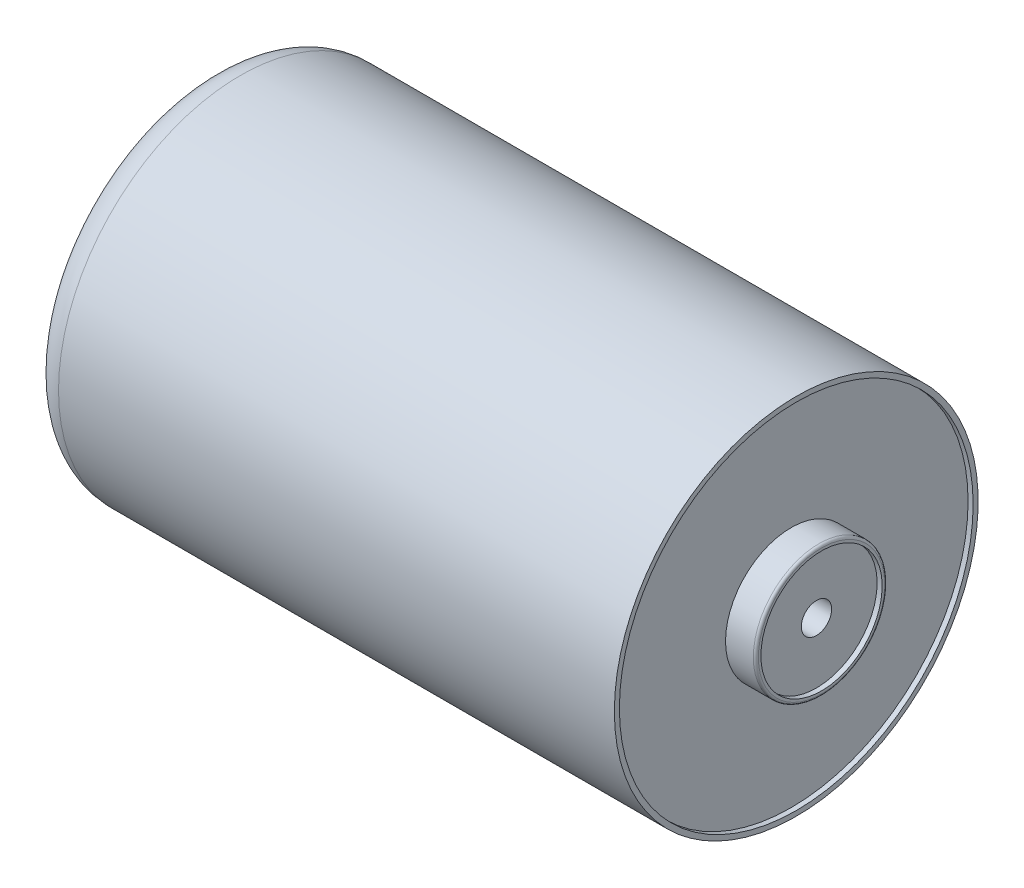
from build123d import *

# Parameters (mm, degrees)
CONG_1_R                = 0.25
CONG_2_R                = 3
ESQUISSE2_R             = 1
ENL_V_MAT_EXTRU_1_DEPTH = 10


with BuildPart() as part:
    # Esquisse1 → Révolution1 (revolve)
    with BuildSketch(Plane.XY, mode=Mode.PRIVATE) as r_volution1_sk:
        Polygon((15.571393841, 1.5), (6.47350081, 1.5), (6.47350081, 6), (5.97350081, 6), (5.97350081, 6.5), (10.47350081, 6.5), (10.47350081, 18), (68.47350081, 18), (68.47350081, 17.502971724), (67.97350081, 17.502971724), (67.97350081, 6.5), (70.97350081, 6.5), (70.97350081, 6), (70.47350081, 6), (70.47350081, 1.5), align=None)
    revolve(r_volution1_sk.sketch.rotate(Axis((0, 0, 0), (1, 0, 0)), 90), axis=Axis((0, 0, 0), (1, 0, 0)))

    # Congé1
    cong_1_edges = [part.edges().sort_by_distance(p)[0] for p in [
        (70.97350081, 0, -6.5),
        (10.47350081, 0, -6.5),
        (5.97350081, 0, -6.5),
    ]]
    fillet(cong_1_edges, radius=CONG_1_R)

    # Congé2
    cong_2_edges = [part.edges().sort_by_distance(p)[0] for p in [
        (10.47350081, 0, -18),
    ]]
    fillet(cong_2_edges, radius=CONG_2_R)

    # Esquisse2 → Enlèv. mat.-Extru.1 (cut)
    with BuildSketch(Plane.ZY.offset(-10.47350081)):
        with Locations((12.5, 0)):
            Circle(ESQUISSE2_R)
        with Locations(Location((-12.5, 0, 0), (0, 0, 180))):
            Circle(ESQUISSE2_R)
    extrude(amount=-ENL_V_MAT_EXTRU_1_DEPTH, mode=Mode.SUBTRACT)


solid = part.part
